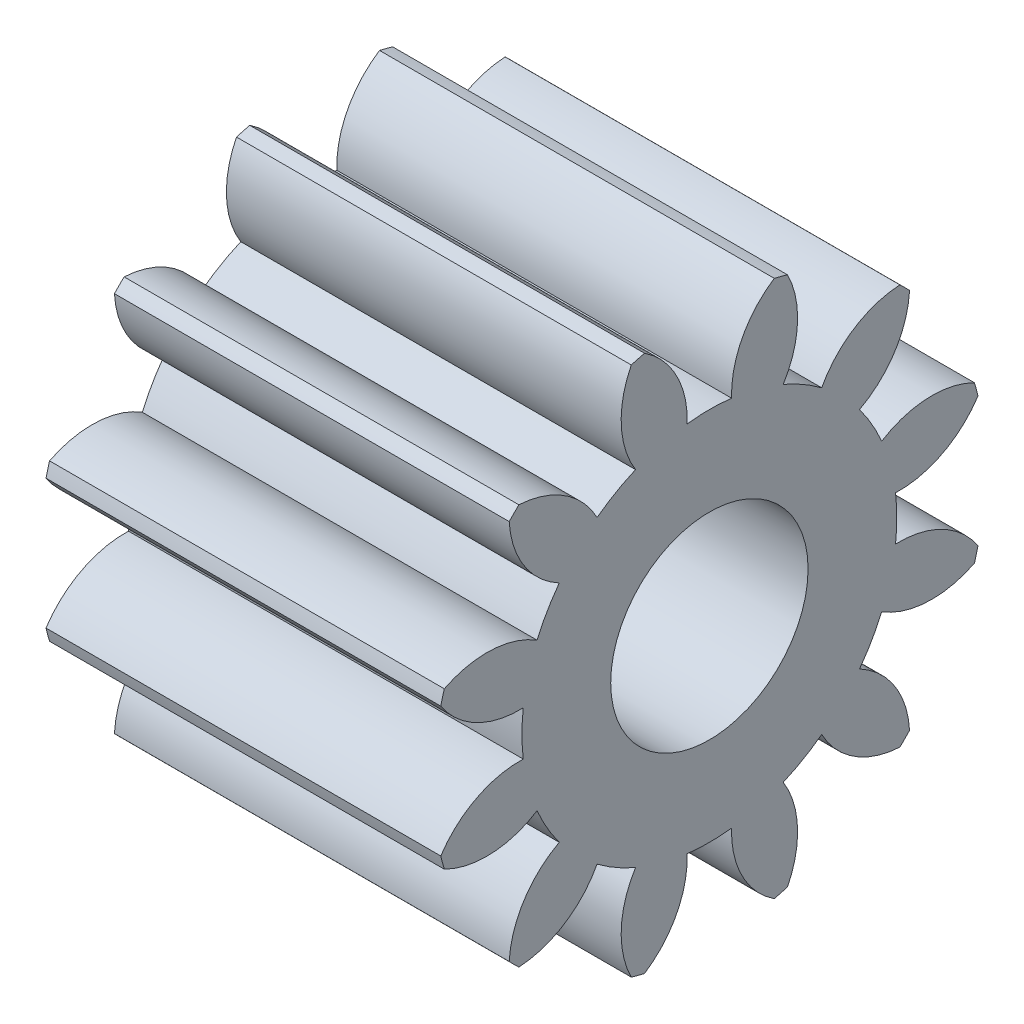
from build123d import *

# Parameters (mm, degrees)
BASPROSKE_W     = 10
BASPROSKE_H     = 7
TOOTHCUT_DEPTH  = 15.071247279
TEETHCUTS_COUNT = 12
TEETHCUTS_ANGLE = 330
BORSKE_R        = 2.5
BORE_DEPTH      = 50.0000508


with BuildPart() as part:
    # BasProSke → Base-Revolve (revolve)
    with BuildSketch(Plane(origin=(0, 0, 0), x_dir=(1, 0, 0), z_dir=(0, 1, 0)), mode=Mode.PRIVATE) as base_revolve_sk:
        with Locations((5, 3.5)):
            Rectangle(BASPROSKE_W, BASPROSKE_H)
    revolve(base_revolve_sk.sketch.rotate(Axis((-10, 0, 0), (1, 0, 0)), 180), axis=Axis((-10, 0, 0), (1, 0, 0)))

    # TooCutSke → ToothCut (cut, through all)
    with BuildSketch(Plane(origin=(0, 0, 0), x_dir=(0, 0, -1), z_dir=(1, 0, 0))):
        with BuildLine():
            ThreePointArc((0.562207301, 4.715604304), (0, 4.749), (-0.562207301, 4.715604304))
            ThreePointArc((-0.562207301, 4.715604304), (-0.837528627, 5.917009812), (-1.672850686, 6.823328788))
            ThreePointArc((-1.672850686, 6.823328788), (0, 7.0254), (1.672850686, 6.823328788))
            ThreePointArc((1.672850686, 6.823328788), (0.837528627, 5.917009812), (0.562207301, 4.715604304))
        make_face()
    toothcut = extrude(amount=TOOTHCUT_DEPTH, mode=Mode.SUBTRACT)

    # TeethCuts: ToothCut ×12 about axis
    teethcuts_axis = Axis((-10, 0, 0), (1, 0, 0))
    for i in range(1, TEETHCUTS_COUNT):
        add(toothcut.rotate(teethcuts_axis, i * TEETHCUTS_ANGLE / (TEETHCUTS_COUNT - 1)), mode=Mode.SUBTRACT)

    # BorSke → Bore (cut, symmetric)
    with BuildSketch(Plane(origin=(0, 0, 0), x_dir=(0, 0, -1), z_dir=(1, 0, 0))):
        with Locations(Location((0, 0, 0), (0, 0, 180))):
            Circle(BORSKE_R)
    extrude(amount=BORE_DEPTH, both=True, mode=Mode.SUBTRACT)


solid = part.part
